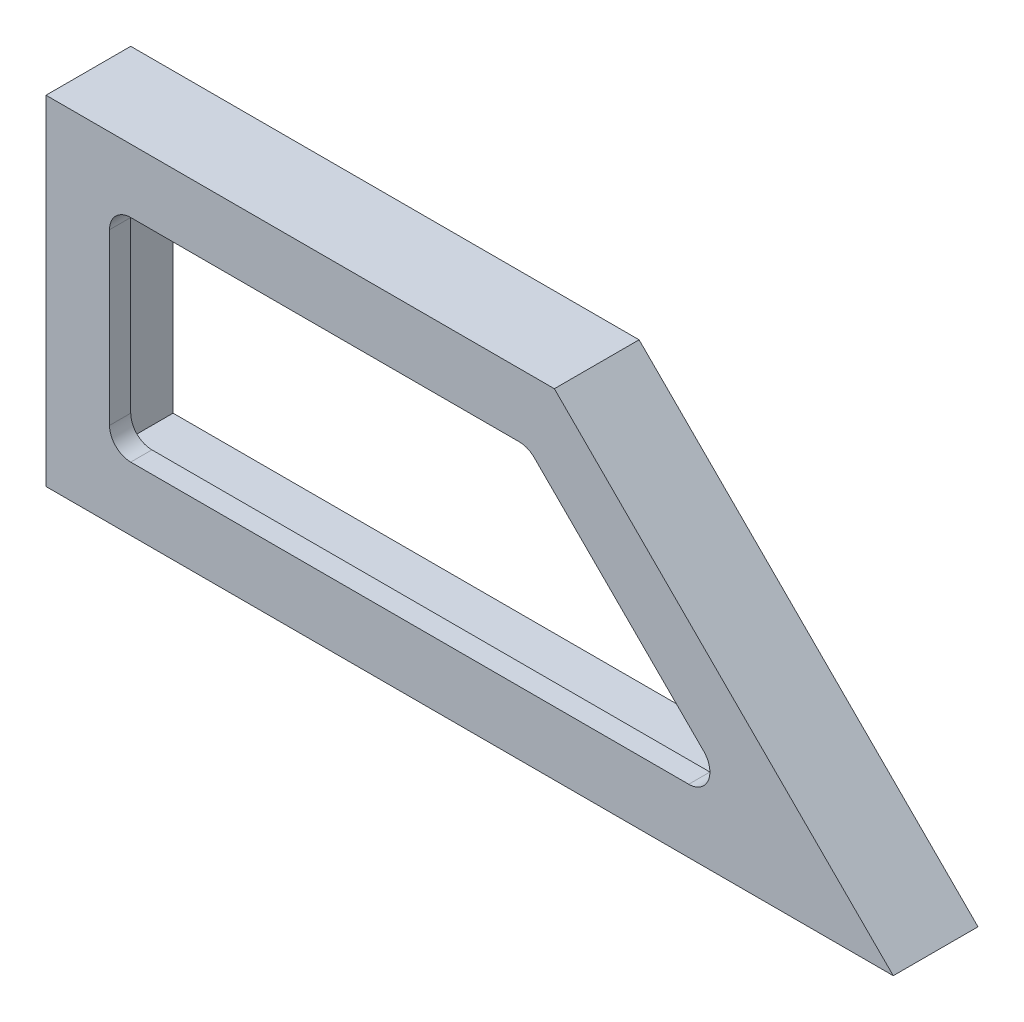
from build123d import *

# Parameters (mm, degrees)
BOSS_EXTRUDE1_DEPTH = 2
CUT_EXTRUDE1_DEPTH  = 15.560219779
CUT_EXTRUDE2_DEPTH  = 1.5
FILLET1_R           = 0.5


with BuildPart() as part:
    # Sketch1 → Boss-Extrude1 (new body)
    with BuildSketch(Plane.XY):
        Polygon((0, 8), (8, 0), (0, 0), (-12, 0), (-12, 8), align=None)
    extrude(amount=BOSS_EXTRUDE1_DEPTH)

    # Sketch2 → Cut-Extrude1 (cut, through all)
    with BuildSketch(Plane.XY.offset(2)):
        Polygon((-0.621320344, 6.5), (4.378679656, 1.5), (-0.621320344, 1.5), (-10.5, 1.5), (-10.5, 6.5), align=None)
    extrude(amount=-CUT_EXTRUDE1_DEPTH, mode=Mode.SUBTRACT)

    # Sketch3 → Cut-Extrude2 (cut)
    with BuildSketch(Plane(origin=(0, 0, 0), x_dir=(-1, 0, 0), z_dir=(0, 0, -1))):
        Polygon((0.414213562, 7), (-5.585786438, 1), (0.414213562, 1), (11, 1), (11, 7), align=None)
    extrude(amount=-CUT_EXTRUDE2_DEPTH, mode=Mode.SUBTRACT)

    # Fillet1
    fillet1_edges = [part.edges().sort_by_distance(p)[0] for p in [
        (4.378679656, 1.5, 1.75),
        (-10.5, 1.5, 1.75),
        (-0.621320344, 6.5, 1.75),
        (-10.5, 6.5, 1.75),
    ]]
    fillet(fillet1_edges, radius=FILLET1_R)


solid = part.part
